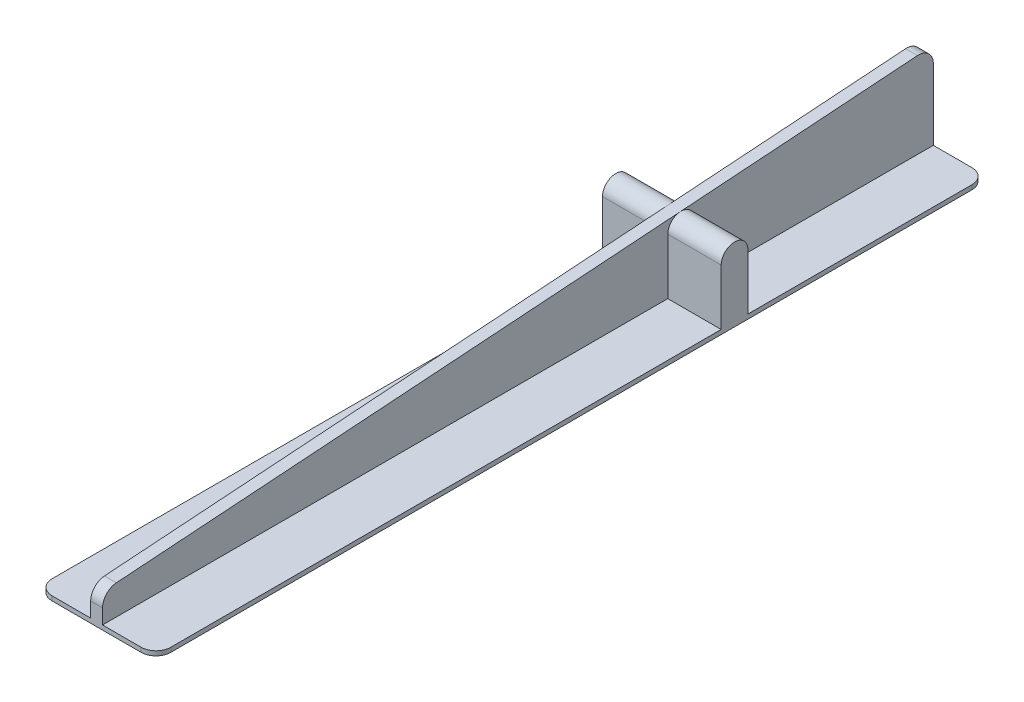
from build123d import *

# Parameters (mm, degrees)
BOSS_EXTRU_1_START      = -85
BOSS_EXTRU_1_DEPTH      = 280
ENL_V_MAT_EXTRU_1_DEPTH = 201.577291835
BOSS_EXTRU_2_REACH      = 203.42
CONG_1_R                = 5


with BuildPart() as part:
    # Esquisse1 → Boss.-Extru.1 (new body)
    with BuildSketch(Plane.XY.offset(BOSS_EXTRU_1_START)):
        Polygon((2, 1.5), (20, 1.5), (20, 0), (-20, 0), (-20, 1.5), (-2, 1.5), (-2, 41.5), (2, 41.5), align=None)
    extrude(amount=BOSS_EXTRU_1_DEPTH)

    # Esquisse3 → Enlèv. mat.-Extru.1 (cut, through all)
    with BuildSketch(Plane(origin=(2, 0, 0), x_dir=(0, 0, -1), z_dir=(1, 0, 0))):
        Polygon((-195, 41.5), (85, 41.5), (85, 30.743779015), (-195, 11.164271671), align=None)
    extrude(amount=-ENL_V_MAT_EXTRU_1_DEPTH, mode=Mode.SUBTRACT)

    # Boss.-Extru.2: up to this face of the body (flat: up to its plane)
    boss_extru_2_end = Plane(part.part.faces().sort_by_distance((-20, 0.75, 55))[0])
    # Esquisse2 → Boss.-Extru.2 (add, up to the picked face)
    with BuildSketch(Plane(origin=(20, 0, 0), x_dir=(0, 0, -1), z_dir=(1, 0, 0)), mode=Mode.PRIVATE) as boss_extru_2_sk1:
        with BuildLine():
            Line((-4.5, 0), (4.5, 0))
            Line((4.5, 0), (4.5, 20.289011459))
            ThreePointArc((4.5, 20.289011459), (0, 24.789011459), (-4.5, 20.289011459))
            Line((-4.5, 20.289011459), (-4.5, 0))
        make_face()
    boss_extru_2_tool1 = split(extrude(boss_extru_2_sk1.sketch, amount=-BOSS_EXTRU_2_REACH, mode=Mode.PRIVATE), bisect_by=boss_extru_2_end, keep=Keep.BOTH, mode=Mode.PRIVATE)
    add(boss_extru_2_tool1.solids().sort_by(Axis((20, 11.932824, 0), (-1, 0, 0)))[0])

    # Congé1
    cong_1_edges = [part.edges().sort_by_distance(p)[0] for p in [
        (-20, 0.75, 195),
        (20, 0.75, 195),
        (0, 30.743779015, -85),
        (0, 11.164271671, 195),
        (20, 0.75, -85),
        (-20, 0.75, -85),
    ]]
    fillet(cong_1_edges, radius=CONG_1_R)


solid = part.part
